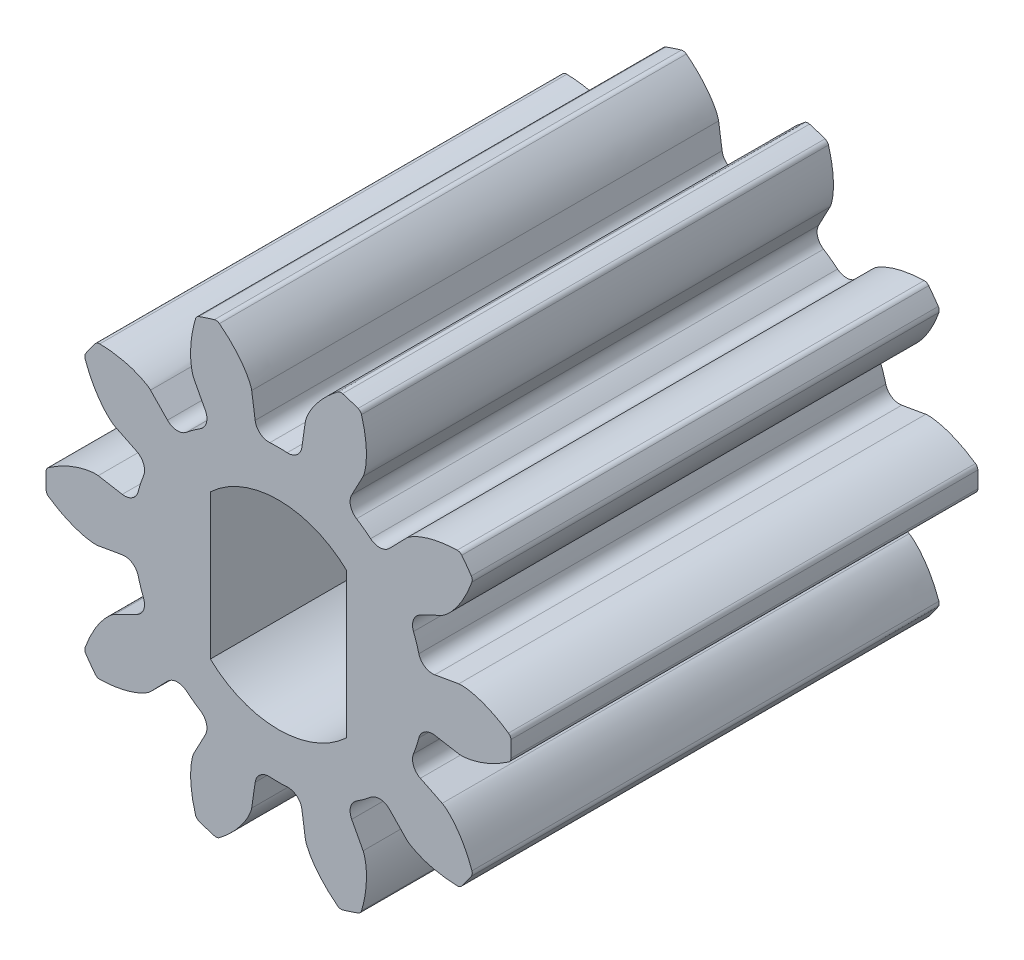
from build123d import *

# Parameters (mm, degrees)
SKETCH1_R                                 = 6.35
BOSS_EXTRUDE1_DEPTH                       = 12.7
CUT_EXTRUDE_DCLTBC_DEPTH                  = 16.554259867
FILLET_TIP_DCLTBC_R                       = 0.177538081
FILLET_ROOT_DCLTBC_R                      = 0.355076163
CIRPATTERN_DCLTBC_COUNT                   = 10
FILLET_TIP_DCLTBC_OF_CIRPATTERN_DCLTBC_R  = 0.177538081
FILLET_ROOT_DCLTBC_OF_CIRPATTERN_DCLTBC_R = 0.355076163
SKETCH4_R                                 = 2.7051
CUT_EXTRUDE2_DEPTH                        = 16.458216095
BOSS_EXTRUDE2_DEPTH                       = 12.7
BOSS_EXTRUDE3_DEPTH                       = 3.175
SKETCH8_OUTSIDE_W                         = 19.044
SKETCH8_OUTSIDE_H                         = 18.566
CUT_EXTRUDE3_DEPTH                        = 16.458216095


with BuildPart() as part:
    # Sketch1 → Boss-Extrude1 (new body)
    with BuildSketch(Plane.XY):
        Circle(SKETCH1_R)
    extrude(amount=BOSS_EXTRUDE1_DEPTH)

    # DCLTBC → Cut-Extrude-DCLTBC (cut, through all)
    with BuildSketch(Plane.XY):
        with BuildLine():
            Line((-0.704592769, 4.922367749), (-0.562358973, 3.92870576))
            ThreePointArc((-0.562358973, 3.92870576), (0, 3.96875), (0.562358973, 3.92870576))
            Line((0.562358973, 3.92870576), (0.704592769, 4.922367749))
            add(Edge.make_bspline(
                [(0.704592769, 4.922367749), (0.704959911, 4.924657652), (0.706108696, 4.931060486), (0.708749985, 4.9430835), (0.713722219, 4.962562731), (0.72102673, 4.987160391), (0.731572349, 5.01866565), (0.745406167, 5.05537935), (0.762074788, 5.095269011), (0.781776183, 5.138134197), (0.802804874, 5.18039699), (0.82504792, 5.222061634), (0.848339645, 5.263102092), (0.87787829, 5.312237624), (0.915131441, 5.370333793), (0.961301537, 5.436965609), (1.016733636, 5.510974525), (1.076438178, 5.584628915), (1.137804354, 5.65561363), (1.202739614, 5.72552362), (1.267642643, 5.791874617), (1.337964359, 5.858824087), (1.404363156, 5.919628028), (1.481874196, 5.98546848), (1.545347028, 6.037944392), (1.613447979, 6.090182881), (1.646963442, 6.115313985), (1.664246535, 6.128032594)],
                knots=[0, 0, 0, 0, 0, 0.005376749, 0.015083688, 0.02853182, 0.046610139, 0.064854849, 0.092110525, 0.119476176, 0.146842496, 0.174208854, 0.201574956, 0.228941013, 0.256307345, 0.307035032, 0.361767352, 0.41649966, 0.471231936, 0.525964282, 0.580696615, 0.635428982, 0.690161387, 0.744893688, 0.799626082, 0.854358408, 0.909090915, 0.909090915, 0.909090915, 0.909090915, 0.909090915], degree=4))
            ThreePointArc((1.664246535, 6.128032594), (0, 6.35), (-1.664246535, 6.128032594))
            add(Edge.make_bspline(
                [(-0.704592769, 4.922367749), (-0.704959911, 4.924657652), (-0.706108696, 4.931060486), (-0.708749985, 4.9430835), (-0.713722219, 4.962562731), (-0.72102673, 4.987160391), (-0.731572349, 5.01866565), (-0.745406167, 5.05537935), (-0.762074788, 5.095269011), (-0.781776183, 5.138134197), (-0.802804874, 5.18039699), (-0.82504792, 5.222061634), (-0.848339645, 5.263102092), (-0.87787829, 5.312237624), (-0.915131441, 5.370333793), (-0.961301537, 5.436965609), (-1.016733636, 5.510974525), (-1.076438178, 5.584628915), (-1.137804354, 5.65561363), (-1.202739614, 5.72552362), (-1.267642643, 5.791874617), (-1.337964359, 5.858824087), (-1.404363156, 5.919628028), (-1.481874196, 5.98546848), (-1.545347028, 6.037944392), (-1.613447979, 6.090182881), (-1.646963442, 6.115313985), (-1.664246535, 6.128032594)],
                knots=[0, 0, 0, 0, 0, 0.005376749, 0.015083688, 0.02853182, 0.046610139, 0.064854849, 0.092110525, 0.119476176, 0.146842496, 0.174208854, 0.201574956, 0.228941013, 0.256307345, 0.307035032, 0.361767352, 0.41649966, 0.471231936, 0.525964282, 0.580696615, 0.635428982, 0.690161387, 0.744893688, 0.799626082, 0.854358408, 0.909090915, 0.909090915, 0.909090915, 0.909090915, 0.909090915], degree=4))
        make_face()
    cut_extrude_dcltbc = extrude(amount=CUT_EXTRUDE_DCLTBC_DEPTH, mode=Mode.SUBTRACT)

    # Fillet-Tip-DCLTBC
    fillet_tip_dcltbc_edges = [part.edges().sort_by_distance(p)[0] for p in [
        (1.664246535, 6.128032594, 6.35),
        (-1.664246535, 6.128032594, 6.35),
    ]]
    fillet(fillet_tip_dcltbc_edges, radius=FILLET_TIP_DCLTBC_R)

    # Fillet-Root-DCLTBC
    fillet_root_dcltbc_edges = [part.edges().sort_by_distance(p)[0] for p in [
        (0.562358973, 3.92870576, 6.35),
        (-0.562358973, 3.92870576, 6.35),
    ]]
    fillet(fillet_root_dcltbc_edges, radius=FILLET_ROOT_DCLTBC_R)

    # CirPattern-DCLTBC: Cut-Extrude-DCLTBC ×10 about axis
    cirpattern_dcltbc_axis = Axis((0, 0, 12.7), (0, 0, 1))
    for i in range(1, CIRPATTERN_DCLTBC_COUNT):
        add(cut_extrude_dcltbc.rotate(cirpattern_dcltbc_axis, i * 360 / CIRPATTERN_DCLTBC_COUNT), mode=Mode.SUBTRACT)

    # Fillet-Tip-DCLTBC of CirPattern-DCLTBC
    fillet_tip_dcltbc_of_cirpattern_dcltbc_edges = [part.edges().sort_by_distance(p)[0] for p in [
        (-2.255563455, 5.93590208, 6.35),
        (-4.948370914, 3.979462941, 6.35),
        (-5.313824869, 3.476458725, 6.35),
        (-6.342385793, 0.310873702, 6.35),
        (-6.342385793, -0.310873702, 6.35),
        (-5.313824869, -3.476458725, 6.35),
        (-4.948370914, -3.979462941, 6.35),
        (-2.255563455, -5.93590208, 6.35),
        (-1.664246535, -6.128032594, 6.35),
        (1.664246535, -6.128032594, 6.35),
        (2.255563455, -5.93590208, 6.35),
        (4.948370914, -3.979462941, 6.35),
        (5.313824869, -3.476458725, 6.35),
        (6.342385793, -0.310873702, 6.35),
        (6.342385793, 0.310873702, 6.35),
        (5.313824869, 3.476458725, 6.35),
        (4.948370914, 3.979462941, 6.35),
        (2.255563455, 5.93590208, 6.35),
    ]]
    fillet(fillet_tip_dcltbc_of_cirpattern_dcltbc_edges, radius=FILLET_TIP_DCLTBC_OF_CIRPATTERN_DCLTBC_R)

    # Fillet-Root-DCLTBC of CirPattern-DCLTBC
    fillet_root_dcltbc_of_cirpattern_dcltbc_edges = [part.edges().sort_by_distance(p)[0] for p in [
        (-1.854277341, 3.508936036, 6.35),
        (-2.764193272, 2.847843415, 6.35),
        (-3.562642734, 1.748872011, 6.35),
        (-3.910199693, 0.67920168, 6.35),
        (-3.910199693, -0.67920168, 6.35),
        (-3.562642734, -1.748872011, 6.35),
        (-2.764193272, -2.847843415, 6.35),
        (-1.854277341, -3.508936036, 6.35),
        (-0.562358973, -3.92870576, 6.35),
        (0.562358973, -3.92870576, 6.35),
        (1.854277341, -3.508936036, 6.35),
        (2.764193272, -2.847843415, 6.35),
        (3.562642734, -1.748872011, 6.35),
        (3.910199693, -0.67920168, 6.35),
        (3.910199693, 0.67920168, 6.35),
        (3.562642734, 1.748872011, 6.35),
        (2.764193272, 2.847843415, 6.35),
        (1.854277341, 3.508936036, 6.35),
    ]]
    fillet(fillet_root_dcltbc_of_cirpattern_dcltbc_edges, radius=FILLET_ROOT_DCLTBC_OF_CIRPATTERN_DCLTBC_R)

    # Sketch4 → Cut-Extrude2 (cut, through all)
    with BuildSketch(Plane.XY.offset(12.7)):
        Circle(SKETCH4_R)
    extrude(amount=-CUT_EXTRUDE2_DEPTH, mode=Mode.SUBTRACT)

    # Sketch5 → Boss-Extrude2 (add, through all)
    with BuildSketch(Plane.XY.offset(12.7)):
        with BuildLine():
            Line((-1.8542, -1.969646763), (-1.8542, 1.969646763))
            ThreePointArc((-1.8542, 1.969646763), (-2.7051, 0), (-1.8542, -1.969646763))
        make_face()
        with BuildLine():
            ThreePointArc((2.7051, 0), (2.483280334, 1.072792988), (1.8542, 1.969646763))
            Line((1.8542, 1.969646763), (1.8542, -1.969646763))
            ThreePointArc((1.8542, -1.969646763), (2.483280334, -1.072792988), (2.7051, 0))
        make_face()
    extrude(amount=-BOSS_EXTRUDE2_DEPTH)

    # Sketch6 → Boss-Extrude3 (add)
    with BuildSketch(Plane(origin=(0, 0, 0), x_dir=(-1, 0, 0), z_dir=(0, 0, -1))):
        with BuildLine():
            Line((-1.965452, 2.087825569), (-1.965452, -2.087825569))
            ThreePointArc((-1.965452, -2.087825569), (0, -2.867406), (1.965452, -2.087825569))
            Line((1.965452, -2.087825569), (1.965452, 2.087825569))
            ThreePointArc((1.965452, 2.087825569), (0, 2.867406), (-1.965452, 2.087825569))
        make_face()
    extrude(amount=-BOSS_EXTRUDE3_DEPTH)

    # Sketch8 outside → Cut-Extrude3 (cut, through all)
    with BuildSketch(Plane.XY.offset(12.7)):
        Rectangle(SKETCH8_OUTSIDE_W, SKETCH8_OUTSIDE_H)
        with BuildLine():
            Line((0.729705005, 4.918548722), (0.635746454, 4.262143265))
            ThreePointArc((0.635746454, 4.262143265), (0.499628672, 4.021246207), (0.23630887, 3.936263119))
            ThreePointArc((0.23630887, 3.936263119), (0, 3.94335), (-0.23630887, 3.936263119))
            ThreePointArc((-0.23630887, 3.936263119), (-0.499628672, 4.021246207), (-0.635746454, 4.262143265))
            Line((-0.635746454, 4.262143265), (-0.729705005, 4.918548722))
            add(Edge.make_bspline(
                [(-0.729705005, 4.918548722), (-0.734668329, 4.949223448), (-0.744482801, 4.978118404), (-0.764795952, 5.035657298), (-0.776283502, 5.063938442), (-0.81358842, 5.147739115), (-0.842202617, 5.202048246), (-0.934443465, 5.359023795), (-1.005000626, 5.457088122), (-1.235817715, 5.737368487), (-1.415061714, 5.905139204), (-1.608238546, 6.053953612)],
                knots=[0, 0, 0, 0, 0.0625, 0.0625, 0.125, 0.125, 0.25, 0.25, 0.5, 0.5, 1, 1, 1, 1], degree=3))
            ThreePointArc((-1.608238546, 6.053953612), (-1.672560711, 6.082871128), (-1.743011846, 6.079677201))
            ThreePointArc((-1.743011846, 6.079677201), (-1.954408883, 6.015052043), (-2.163418392, 5.943078834))
            ThreePointArc((-2.163418392, 5.943078834), (-2.222291901, 5.904252637), (-2.257332337, 5.843050254))
            add(Edge.make_bspline(
                [(-2.257332337, 5.843050254), (-2.326061849, 5.609392256), (-2.372443623, 5.369101857), (-2.394547537, 5.005647223), (-2.393919211, 4.883253154), (-2.376143436, 4.702148217), (-2.367429449, 4.64214294), (-2.348433035, 4.552906394), (-2.341082292, 4.52319786), (-2.323664931, 4.464686448), (-2.31458349, 4.435560198), (-2.300706652, 4.408099344)],
                knots=[0, 0, 0, 0, 0.5, 0.5, 0.75, 0.75, 0.875, 0.875, 0.9375, 0.9375, 1, 1, 1, 1], degree=3))
            Line((-2.300706652, 4.408099344), (-1.990895269, 3.821828724))
            ThreePointArc((-1.990895269, 3.821828724), (-1.95942113, 3.546930885), (-2.122499519, 3.323402626))
            ThreePointArc((-2.122499519, 3.323402626), (-2.317842975, 3.190237165), (-2.504855302, 3.045604889))
            ThreePointArc((-2.504855302, 3.045604889), (-2.767837302, 2.959582155), (-3.01955464, 3.074463944))
            Line((-3.01955464, 3.074463944), (-3.481394152, 3.550279664))
            add(Edge.make_bspline(
                [(-3.481394152, 3.550279664), (-3.503439716, 3.572178669), (-3.52836382, 3.589786377), (-3.578618018, 3.62439655), (-3.60453488, 3.640524264), (-3.683971993, 3.686393152), (-3.739043471, 3.713511159), (-3.905935796, 3.786289236), (-4.020658504, 3.824152484), (-4.372138117, 3.915233182), (-4.615762711, 3.945605564), (-4.859516966, 3.952452456)],
                knots=[0, 0, 0, 0, 0.0625, 0.0625, 0.125, 0.125, 0.25, 0.25, 0.5, 0.5, 1, 1, 1, 1], degree=3))
            ThreePointArc((-4.859516966, 3.952452456), (-4.92855198, 3.938039598), (-4.983670802, 3.894045518))
            ThreePointArc((-4.983670802, 3.894045518), (-5.116708883, 3.717506607), (-5.243496337, 3.53642635))
            ThreePointArc((-5.243496337, 3.53642635), (-5.26830454, 3.470410316), (-5.26067899, 3.400300298))
            add(Edge.make_bspline(
                [(-5.26067899, 3.400300298), (-5.178941608, 3.170868812), (-5.075226098, 2.949207273), (-4.879475267, 2.642173943), (-4.807025512, 2.543524382), (-4.686193797, 2.407455749), (-4.643873816, 2.364032413), (-4.576053469, 2.303004343), (-4.552644355, 2.283290292), (-4.504161269, 2.246191233), (-4.479694249, 2.227965539), (-4.452326566, 2.213905843)],
                knots=[0, 0, 0, 0, 0.5, 0.5, 0.75, 0.75, 0.875, 0.875, 0.9375, 0.9375, 1, 1, 1, 1], degree=3))
            Line((-4.452326566, 2.213905843), (-3.857082667, 1.921705509))
            ThreePointArc((-3.857082667, 1.921705509), (-3.670038658, 1.717808521), (-3.670585232, 1.441115288))
            ThreePointArc((-3.670585232, 1.441115288), (-3.750348714, 1.218562165), (-3.816632146, 0.991629108))
            ThreePointArc((-3.816632146, 0.991629108), (-3.978826159, 0.767458312), (-4.249995584, 0.712443893))
            Line((-4.249995584, 0.712443893), (-4.903309061, 0.825924443))
            add(Edge.make_bspline(
                [(-4.903309061, 0.825924443), (-4.93401621, 0.830683053), (-4.964529785, 0.830277967), (-5.025529633, 0.828739509), (-5.055976448, 0.826553554), (-5.147203478, 0.816970301), (-5.207696804, 0.806539027), (-5.385493412, 0.76732088), (-5.500561491, 0.730520575), (-5.838450362, 0.597611875), (-6.053399237, 0.478984704), (-6.254625074, 0.341248801)],
                knots=[0, 0, 0, 0, 0.0625, 0.0625, 0.125, 0.125, 0.25, 0.25, 0.5, 0.5, 1, 1, 1, 1], degree=3))
            ThreePointArc((-6.254625074, 0.341248801), (-6.302003908, 0.28901079), (-6.320736901, 0.221020801))
            ThreePointArc((-6.320736901, 0.221020801), (-6.3246, 0), (-6.320736901, -0.221020801))
            ThreePointArc((-6.320736901, -0.221020801), (-6.302003908, -0.28901079), (-6.254625074, -0.341248801))
            add(Edge.make_bspline(
                [(-6.254625074, -0.341248801), (-6.053641698, -0.478818744), (-5.839444705, -0.597184249), (-5.500609292, -0.730519979), (-5.384011452, -0.767744253), (-5.206277405, -0.806802989), (-5.146516225, -0.817058145), (-5.055777012, -0.826567091), (-5.025251013, -0.828756561), (-4.964221093, -0.830272688), (-4.933714063, -0.83063623), (-4.903309061, -0.825924443)],
                knots=[0, 0, 0, 0, 0.5, 0.5, 0.75, 0.75, 0.875, 0.875, 0.9375, 0.9375, 1, 1, 1, 1], degree=3))
            Line((-4.903309061, -0.825924443), (-4.249995584, -0.712443893))
            ThreePointArc((-4.249995584, -0.712443893), (-3.978826159, -0.767458312), (-3.816632146, -0.991629108))
            ThreePointArc((-3.816632146, -0.991629108), (-3.750348714, -1.218562165), (-3.670585232, -1.441115288))
            ThreePointArc((-3.670585232, -1.441115288), (-3.670038658, -1.717808521), (-3.857082667, -1.921705509))
            Line((-3.857082667, -1.921705509), (-4.452326566, -2.213905843))
            add(Edge.make_bspline(
                [(-4.452326566, -2.213905843), (-4.479966212, -2.228105256), (-4.504414109, -2.246368406), (-4.55285974, -2.283467857), (-4.576206859, -2.30313252), (-4.644378182, -2.364507438), (-4.687186961, -2.4085036), (-4.80797559, -2.544737972), (-4.879436945, -2.642145364), (-5.07467301, -2.948276856), (-5.178843002, -3.170592032), (-5.26067899, -3.400300298)],
                knots=[0, 0, 0, 0, 0.0625, 0.0625, 0.125, 0.125, 0.25, 0.25, 0.5, 0.5, 1, 1, 1, 1], degree=3))
            ThreePointArc((-5.26067899, -3.400300298), (-5.26830454, -3.470410316), (-5.243496337, -3.53642635))
            ThreePointArc((-5.243496337, -3.53642635), (-5.116708883, -3.717506607), (-4.983670802, -3.894045518))
            ThreePointArc((-4.983670802, -3.894045518), (-4.92855198, -3.938039598), (-4.859516966, -3.952452456))
            add(Edge.make_bspline(
                [(-4.859516966, -3.952452456), (-4.616056416, -3.945613814), (-4.37319391, -3.915471685), (-4.020697527, -3.824180098), (-3.904488013, -3.785760677), (-3.73774, -3.712890408), (-3.68336436, -3.686060263), (-3.604365576, -3.64041799), (-3.578382586, -3.624246577), (-3.528117187, -3.589600662), (-3.503222796, -3.571963192), (-3.481394152, -3.550279664)],
                knots=[0, 0, 0, 0, 0.5, 0.5, 0.75, 0.75, 0.875, 0.875, 0.9375, 0.9375, 1, 1, 1, 1], degree=3))
            Line((-3.481394152, -3.550279664), (-3.01955464, -3.074463944))
            ThreePointArc((-3.01955464, -3.074463944), (-2.767837302, -2.959582155), (-2.504855302, -3.045604889))
            ThreePointArc((-2.504855302, -3.045604889), (-2.317842975, -3.190237165), (-2.122499519, -3.323402626))
            ThreePointArc((-2.122499519, -3.323402626), (-1.95942113, -3.546930885), (-1.990895269, -3.821828724))
            Line((-1.990895269, -3.821828724), (-2.300706652, -4.408099344))
            add(Edge.make_bspline(
                [(-2.300706652, -4.408099344), (-2.31472139, -4.435833087), (-2.323765344, -4.4649784), (-2.341152172, -4.523468113), (-2.348481789, -4.553100252), (-2.367558276, -4.642823702), (-2.376331011, -4.703579714), (-2.39397451, -4.884793411), (-2.394533333, -5.005601577), (-2.37254305, -5.368024036), (-2.326144762, -5.609110377), (-2.257332337, -5.843050254)],
                knots=[0, 0, 0, 0, 0.0625, 0.0625, 0.125, 0.125, 0.25, 0.25, 0.5, 0.5, 1, 1, 1, 1], degree=3))
            ThreePointArc((-2.257332337, -5.843050254), (-2.222291901, -5.904252637), (-2.163418392, -5.943078834))
            ThreePointArc((-2.163418392, -5.943078834), (-1.954408883, -6.015052043), (-1.743011846, -6.079677201))
            ThreePointArc((-1.743011846, -6.079677201), (-1.672560711, -6.082871128), (-1.608238546, -6.053953612))
            add(Edge.make_bspline(
                [(-1.608238546, -6.053953612), (-1.415294476, -5.905318514), (-1.236531681, -5.73818202), (-1.005015964, -5.457133399), (-0.933582862, -5.357745197), (-0.841512956, -5.200779887), (-0.813292502, -5.147112645), (-0.776208998, -5.06375295), (-0.764693636, -5.035397583), (-0.744392432, -4.977823189), (-0.734619492, -4.948921621), (-0.729705005, -4.918548722)],
                knots=[0, 0, 0, 0, 0.5, 0.5, 0.75, 0.75, 0.875, 0.875, 0.9375, 0.9375, 1, 1, 1, 1], degree=3))
            Line((-0.729705005, -4.918548722), (-0.635746454, -4.262143265))
            ThreePointArc((-0.635746454, -4.262143265), (-0.499628672, -4.021246207), (-0.23630887, -3.936263119))
            ThreePointArc((-0.23630887, -3.936263119), (0, -3.94335), (0.23630887, -3.936263119))
            ThreePointArc((0.23630887, -3.936263119), (0.499628672, -4.021246207), (0.635746454, -4.262143265))
            Line((0.635746454, -4.262143265), (0.729705005, -4.918548722))
            add(Edge.make_bspline(
                [(0.729705005, -4.918548722), (0.734668329, -4.949223448), (0.744482801, -4.978118404), (0.764795952, -5.035657298), (0.776283502, -5.063938442), (0.81358842, -5.147739115), (0.842202617, -5.202048246), (0.934443465, -5.359023795), (1.005000626, -5.457088122), (1.235817715, -5.737368487), (1.415061714, -5.905139204), (1.608238546, -6.053953612)],
                knots=[0, 0, 0, 0, 0.0625, 0.0625, 0.125, 0.125, 0.25, 0.25, 0.5, 0.5, 1, 1, 1, 1], degree=3))
            ThreePointArc((1.608238546, -6.053953612), (1.672560711, -6.082871128), (1.743011846, -6.079677201))
            ThreePointArc((1.743011846, -6.079677201), (1.954408883, -6.015052043), (2.163418392, -5.943078834))
            ThreePointArc((2.163418392, -5.943078834), (2.222291901, -5.904252637), (2.257332337, -5.843050254))
            add(Edge.make_bspline(
                [(2.257332337, -5.843050254), (2.326061849, -5.609392256), (2.372443623, -5.369101857), (2.394547537, -5.005647223), (2.393919211, -4.883253154), (2.376143436, -4.702148217), (2.367429449, -4.64214294), (2.348433035, -4.552906394), (2.341082292, -4.52319786), (2.323664931, -4.464686448), (2.31458349, -4.435560198), (2.300706652, -4.408099344)],
                knots=[0, 0, 0, 0, 0.5, 0.5, 0.75, 0.75, 0.875, 0.875, 0.9375, 0.9375, 1, 1, 1, 1], degree=3))
            Line((2.300706652, -4.408099344), (1.990895269, -3.821828724))
            ThreePointArc((1.990895269, -3.821828724), (1.95942113, -3.546930885), (2.122499519, -3.323402626))
            ThreePointArc((2.122499519, -3.323402626), (2.317842975, -3.190237165), (2.504855302, -3.045604889))
            ThreePointArc((2.504855302, -3.045604889), (2.767837302, -2.959582155), (3.01955464, -3.074463944))
            Line((3.01955464, -3.074463944), (3.481394152, -3.550279664))
            add(Edge.make_bspline(
                [(3.481394152, -3.550279664), (3.503439716, -3.572178669), (3.52836382, -3.589786377), (3.578618018, -3.62439655), (3.60453488, -3.640524264), (3.683971993, -3.686393152), (3.739043471, -3.713511159), (3.905935796, -3.786289236), (4.020658504, -3.824152484), (4.372138117, -3.915233182), (4.615762711, -3.945605564), (4.859516966, -3.952452456)],
                knots=[0, 0, 0, 0, 0.0625, 0.0625, 0.125, 0.125, 0.25, 0.25, 0.5, 0.5, 1, 1, 1, 1], degree=3))
            ThreePointArc((4.859516966, -3.952452456), (4.92855198, -3.938039598), (4.983670802, -3.894045518))
            ThreePointArc((4.983670802, -3.894045518), (5.116708883, -3.717506607), (5.243496337, -3.53642635))
            ThreePointArc((5.243496337, -3.53642635), (5.26830454, -3.470410316), (5.26067899, -3.400300298))
            add(Edge.make_bspline(
                [(5.26067899, -3.400300298), (5.178941608, -3.170868812), (5.075226098, -2.949207273), (4.879475267, -2.642173943), (4.807025512, -2.543524382), (4.686193797, -2.407455749), (4.643873816, -2.364032413), (4.576053469, -2.303004343), (4.552644355, -2.283290292), (4.504161269, -2.246191233), (4.479694249, -2.227965539), (4.452326566, -2.213905843)],
                knots=[0, 0, 0, 0, 0.5, 0.5, 0.75, 0.75, 0.875, 0.875, 0.9375, 0.9375, 1, 1, 1, 1], degree=3))
            Line((4.452326566, -2.213905843), (3.857082667, -1.921705509))
            ThreePointArc((3.857082667, -1.921705509), (3.670038658, -1.717808521), (3.670585232, -1.441115288))
            ThreePointArc((3.670585232, -1.441115288), (3.750348714, -1.218562165), (3.816632146, -0.991629108))
            ThreePointArc((3.816632146, -0.991629108), (3.978826159, -0.767458312), (4.249995584, -0.712443893))
            Line((4.249995584, -0.712443893), (4.903309061, -0.825924443))
            add(Edge.make_bspline(
                [(4.903309061, -0.825924443), (4.93401621, -0.830683053), (4.964529785, -0.830277967), (5.025529633, -0.828739509), (5.055976448, -0.826553554), (5.147203478, -0.816970301), (5.207696804, -0.806539027), (5.385493412, -0.76732088), (5.500561491, -0.730520575), (5.838450362, -0.597611875), (6.053399237, -0.478984704), (6.254625074, -0.341248801)],
                knots=[0, 0, 0, 0, 0.0625, 0.0625, 0.125, 0.125, 0.25, 0.25, 0.5, 0.5, 1, 1, 1, 1], degree=3))
            ThreePointArc((6.254625074, -0.341248801), (6.302003908, -0.28901079), (6.320736901, -0.221020801))
            ThreePointArc((6.320736901, -0.221020801), (6.3246, 0), (6.320736901, 0.221020801))
            ThreePointArc((6.320736901, 0.221020801), (6.302003908, 0.28901079), (6.254625074, 0.341248801))
            add(Edge.make_bspline(
                [(6.254625074, 0.341248801), (6.053641698, 0.478818744), (5.839444705, 0.597184249), (5.500609292, 0.730519979), (5.384011452, 0.767744253), (5.206277405, 0.806802989), (5.146516225, 0.817058145), (5.055777012, 0.826567091), (5.025251013, 0.828756561), (4.964221093, 0.830272688), (4.933714063, 0.83063623), (4.903309061, 0.825924443)],
                knots=[0, 0, 0, 0, 0.5, 0.5, 0.75, 0.75, 0.875, 0.875, 0.9375, 0.9375, 1, 1, 1, 1], degree=3))
            Line((4.903309061, 0.825924443), (4.249995584, 0.712443893))
            ThreePointArc((4.249995584, 0.712443893), (3.978826159, 0.767458312), (3.816632146, 0.991629108))
            ThreePointArc((3.816632146, 0.991629108), (3.750348714, 1.218562165), (3.670585232, 1.441115288))
            ThreePointArc((3.670585232, 1.441115288), (3.670038658, 1.717808521), (3.857082667, 1.921705509))
            Line((3.857082667, 1.921705509), (4.452326566, 2.213905843))
            add(Edge.make_bspline(
                [(4.452326566, 2.213905843), (4.479966212, 2.228105256), (4.504414109, 2.246368406), (4.55285974, 2.283467857), (4.576206859, 2.30313252), (4.644378182, 2.364507438), (4.687186961, 2.4085036), (4.80797559, 2.544737972), (4.879436945, 2.642145364), (5.07467301, 2.948276856), (5.178843002, 3.170592032), (5.26067899, 3.400300298)],
                knots=[0, 0, 0, 0, 0.0625, 0.0625, 0.125, 0.125, 0.25, 0.25, 0.5, 0.5, 1, 1, 1, 1], degree=3))
            ThreePointArc((5.26067899, 3.400300298), (5.26830454, 3.470410316), (5.243496337, 3.53642635))
            ThreePointArc((5.243496337, 3.53642635), (5.116708883, 3.717506607), (4.983670802, 3.894045518))
            ThreePointArc((4.983670802, 3.894045518), (4.92855198, 3.938039598), (4.859516966, 3.952452456))
            add(Edge.make_bspline(
                [(4.859516966, 3.952452456), (4.616056416, 3.945613814), (4.37319391, 3.915471685), (4.020697527, 3.824180098), (3.904488013, 3.785760677), (3.73774, 3.712890408), (3.68336436, 3.686060263), (3.604365576, 3.64041799), (3.578382586, 3.624246577), (3.528117187, 3.589600662), (3.503222796, 3.571963192), (3.481394152, 3.550279664)],
                knots=[0, 0, 0, 0, 0.5, 0.5, 0.75, 0.75, 0.875, 0.875, 0.9375, 0.9375, 1, 1, 1, 1], degree=3))
            Line((3.481394152, 3.550279664), (3.01955464, 3.074463944))
            ThreePointArc((3.01955464, 3.074463944), (2.767837302, 2.959582155), (2.504855302, 3.045604889))
            ThreePointArc((2.504855302, 3.045604889), (2.317842975, 3.190237165), (2.122499519, 3.323402626))
            ThreePointArc((2.122499519, 3.323402626), (1.95942113, 3.546930885), (1.990895269, 3.821828724))
            Line((1.990895269, 3.821828724), (2.300706652, 4.408099344))
            add(Edge.make_bspline(
                [(2.300706652, 4.408099344), (2.31472139, 4.435833087), (2.323765344, 4.4649784), (2.341152172, 4.523468113), (2.348481789, 4.553100252), (2.367558276, 4.642823702), (2.376331011, 4.703579714), (2.39397451, 4.884793411), (2.394533333, 5.005601577), (2.37254305, 5.368024036), (2.326144762, 5.609110377), (2.257332337, 5.843050254)],
                knots=[0, 0, 0, 0, 0.0625, 0.0625, 0.125, 0.125, 0.25, 0.25, 0.5, 0.5, 1, 1, 1, 1], degree=3))
            ThreePointArc((2.257332337, 5.843050254), (2.222291901, 5.904252637), (2.163418392, 5.943078834))
            ThreePointArc((2.163418392, 5.943078834), (1.954408883, 6.015052043), (1.743011846, 6.079677201))
            ThreePointArc((1.743011846, 6.079677201), (1.672560711, 6.082871128), (1.608238546, 6.053953612))
            add(Edge.make_bspline(
                [(1.608238546, 6.053953612), (1.415294476, 5.905318514), (1.236531681, 5.73818202), (1.005015964, 5.457133399), (0.933582862, 5.357745197), (0.841512956, 5.200779887), (0.813292502, 5.147112645), (0.776208998, 5.06375295), (0.764693636, 5.035397583), (0.744392432, 4.977823189), (0.734619492, 4.948921621), (0.729705005, 4.918548722)],
                knots=[0, 0, 0, 0, 0.5, 0.5, 0.75, 0.75, 0.875, 0.875, 0.9375, 0.9375, 1, 1, 1, 1], degree=3))
        make_face(mode=Mode.SUBTRACT)
    extrude(amount=-CUT_EXTRUDE3_DEPTH, mode=Mode.SUBTRACT)


solid = part.part
